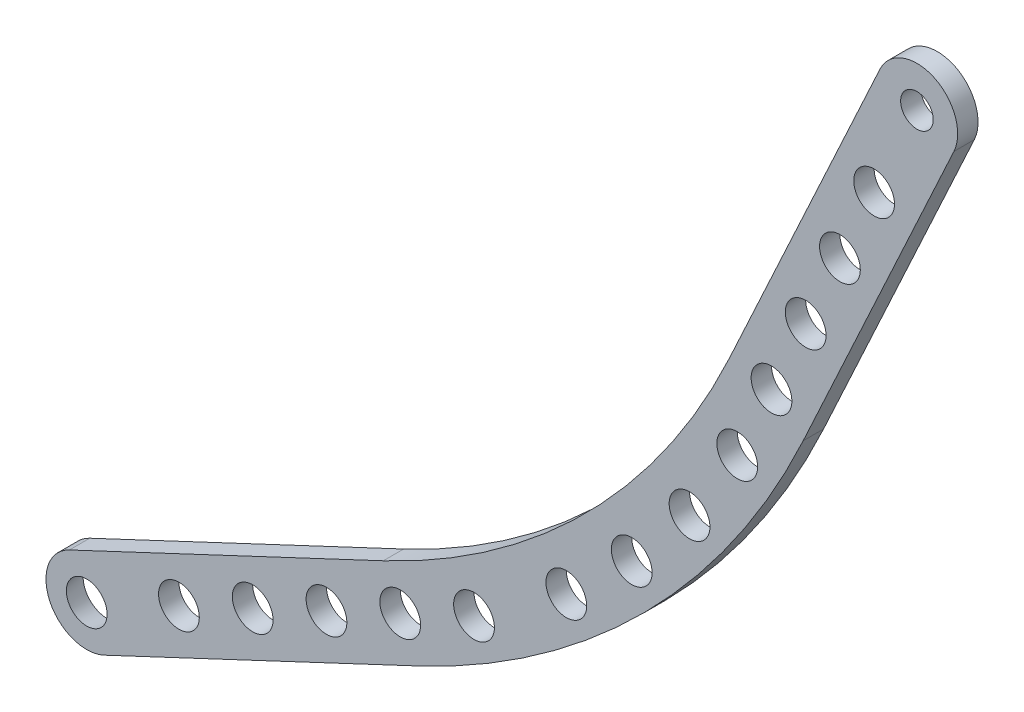
from build123d import *

# Parameters (mm, degrees)
ESQUISSE1_R             = 4
BASE_EXTRUSION_DEPTH    = 5
ESQUISSE4_R             = 5
ENL_V_MAT_EXTRU_1_DEPTH = 184.114841449
ESQUISSE5_R             = 5
ENL_V_MAT_EXTRU_2_DEPTH = 5
ESQUISSE12_R            = 5
ENL_V_MAT_EXTRU_3_DEPTH = 184.114841449


with BuildPart() as part:
    # Esquisse1 → Base-Extrusion (new body)
    with BuildSketch(Plane.XY):
        with BuildLine():
            Line((75.029222277, 91.337855838), (38.048651763, 11.373375441))
            ThreePointArc((38.048651763, 11.373375441), (3.1478246, -38.807248513), (-46.811009341, -74.02482464))
            Line((-46.811009341, -74.02482464), (-123.833766756, -110.238168816))
            ThreePointArc((-123.833766756, -110.238168816), (-128.628603048, -123.542662227), (-115.324109637, -128.33749852))
            Line((-115.324109637, -128.33749852), (-38.301352222, -92.124154344))
            ThreePointArc((-38.301352222, -92.124154344), (17.334621939, -52.904580929), (56.201452189, 2.978386656))
            Line((56.201452189, 2.978386656), (93.182022703, 82.942867053))
            ThreePointArc((93.182022703, 82.942867053), (88.303116883, 96.216761659), (75.029222277, 91.337855838))
        make_face()
        with Locations((84.10562249, 87.140361446)):
            Circle(ESQUISSE1_R, mode=Mode.SUBTRACT)
    extrude(amount=BASE_EXTRUSION_DEPTH)

    # Esquisse3 → Enlèvement de matière-Révolution2 (revolve, cut)
    with BuildSketch(Plane(origin=(24.28345685, -51.648883823, 0), x_dir=(0.9049664851912627, 0.4254828559185108, 0), z_dir=(0.4254828559185108, -0.9049664851912627, 0)), mode=Mode.PRIVATE) as enl_vement_de_mati_re_r_volution2_sk:
        Polygon((-158.969859548, 5), (-153.969859548, 5), (-153.088224644, 0), (-158.969859548, 0), align=None)
    revolve(enl_vement_de_mati_re_r_volution2_sk.sketch.rotate(Axis((-119.578938197, -119.287833668, 13.424474394), (0, 0, -1)), 25.181230443), axis=Axis((-119.578938197, -119.287833668, 13.424474394), (0, 0, -1)), mode=Mode.SUBTRACT)

    # Esquisse4 → Enlèv. mat.-Extru.1 (cut, through all)
    with BuildSketch(Plane.XY.offset(5)):
        with Locations((73.611886508, 64.449360914)):
            Circle(ESQUISSE4_R)
        with Locations((65.216897723, 46.296560488)):
            Circle(ESQUISSE4_R)
        with Locations((56.821908937, 28.143760062)):
            Circle(ESQUISSE4_R)
        with Locations((48.426920152, 9.990959637)):
            Circle(ESQUISSE4_R)
        with Locations((40.031931366, -8.161840789)):
            Circle(ESQUISSE4_R)
    extrude(amount=-ENL_V_MAT_EXTRU_1_DEPTH, mode=Mode.SUBTRACT)

    # Esquisse5 → Enlèv. mat.-Extru.2 (cut)
    with BuildSketch(Plane.XY.offset(5)):
        with Locations((-96.954776067, -108.65076227)):
            Circle(ESQUISSE5_R)
        with Locations((-78.855446363, -100.141105152)):
            Circle(ESQUISSE5_R)
        with Locations((-60.756116659, -91.631448033)):
            Circle(ESQUISSE5_R)
        with Locations((-42.656786955, -83.121790915)):
            Circle(ESQUISSE5_R)
        with Locations((-24.557457251, -74.612133797)):
            Circle(ESQUISSE5_R)
    extrude(amount=-ENL_V_MAT_EXTRU_2_DEPTH, mode=Mode.SUBTRACT)

    # Esquisse12 → Enlèv. mat.-Extru.3 (cut, through all)
    with BuildSketch(Plane.XY.offset(5)):
        with Locations((-1.909251541, -58.652301466)):
            Circle(ESQUISSE12_R)
        with Locations((14.143088399, -43.608286628)):
            Circle(ESQUISSE12_R)
        with Locations((28.319996864, -26.785229047)):
            Circle(ESQUISSE12_R)
    extrude(amount=-ENL_V_MAT_EXTRU_3_DEPTH, mode=Mode.SUBTRACT)


solid = part.part
